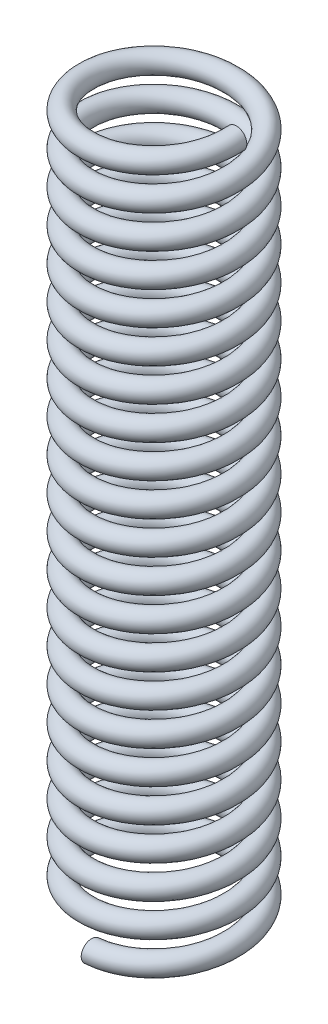
from build123d import *

# Parameters (mm, degrees)
SPRING_PITCH          = 0.8
SPRING_HEIGHT         = 17
SPRING_RADIUS         = 1.75
SPRING_START_ANGLE    = 90
SPRINGBODYDIAMETERS_R = 0.25


with BuildPart() as part:
    # SPRING: sweep along a helix
    with BuildLine() as spring_path:
        add(Helix(SPRING_PITCH, SPRING_HEIGHT, SPRING_RADIUS, center=(0, 0, 0), direction=(0, -1, 0), mode=Mode.PRIVATE).rotate(Axis((0, 0, 0), (0, -1, 0)), SPRING_START_ANGLE))
    # SpringBodyDiameterS → SPRING (sweep)
    with BuildSketch(Plane.XY):
        with Locations((1.75, 0)):
            Circle(SPRINGBODYDIAMETERS_R)
    sweep(path=spring_path.line, is_frenet=True)


solid = part.part
